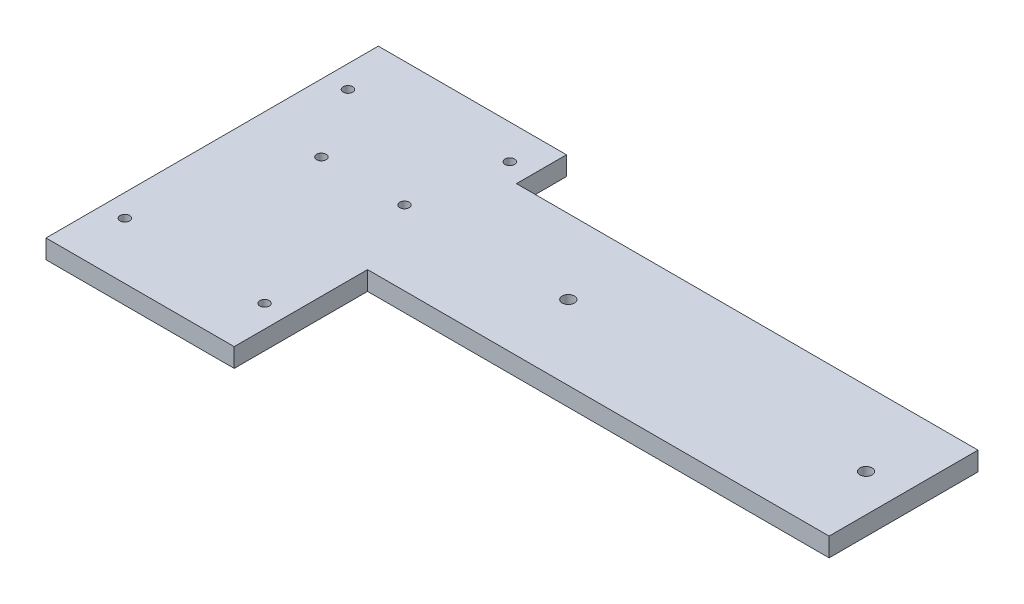
from build123d import *

# Parameters (mm, degrees)
SKETCH1_W           = 63.2
SKETCH1_H           = 111.6
SKETCH1_W_2         = 53.2
SKETCH1_H_2         = 101.6
SKETCH1_R           = 1.6
BOSS_EXTRUDE1_DEPTH = 6.35
SKETCH2_W           = 155
SKETCH2_H           = 50
SKETCH2_R           = 2.05
BOSS_EXTRUDE2_DEPTH = 6.35


with BuildPart() as part:
    # Sketch1 → Boss-Extrude1 (new body)
    # profile 1 of 2: a face of its own
    with BuildSketch(Plane(origin=(0, 0, 0), x_dir=(1, 0, 0), z_dir=(0, 1, 0))):
        with Locations((-26.6, 50.8)):
            Rectangle(SKETCH1_W, SKETCH1_H)
        with Locations((-26.6, 50.8)):
            Rectangle(SKETCH1_W_2, SKETCH1_H_2, mode=Mode.SUBTRACT)
    # profile 2 of 2: a face of its own
    with BuildSketch(Plane(origin=(0, 0, 0), x_dir=(1, 0, 0), z_dir=(0, 1, 0))):
        with Locations((-26.6, 50.8)):
            Rectangle(SKETCH1_W_2, SKETCH1_H_2)
        with Locations(Location((-2.5, 12.7, 0), (0, 0, 270))):
            Circle(SKETCH1_R, mode=Mode.SUBTRACT)
        with Locations(Location((-50.7, 14, 0), (0, 0, 270))):
            Circle(SKETCH1_R, mode=Mode.SUBTRACT)
        with Locations(Location((-7.6, 64.8, 0), (0, 0, 270))):
            Circle(SKETCH1_R, mode=Mode.SUBTRACT)
        with Locations(Location((-35.5, 64.8, 0), (0, 0, 270))):
            Circle(SKETCH1_R, mode=Mode.SUBTRACT)
        with Locations(Location((-2.5, 95.05, 0), (0, 0, 270))):
            Circle(SKETCH1_R, mode=Mode.SUBTRACT)
        with Locations(Location((-50.7, 88.9, 0), (0, 0, 270))):
            Circle(SKETCH1_R, mode=Mode.SUBTRACT)
    extrude(amount=BOSS_EXTRUDE1_DEPTH)

    # Sketch2 → Boss-Extrude2 (add)
    with BuildSketch(Plane(origin=(0, 6.35, 0), x_dir=(1, 0, 0), z_dir=(0, 1, 0))):
        with Locations((82.5, 64.8)):
            Rectangle(SKETCH2_W, SKETCH2_H)
        with Locations(Location((47.4, 64.8, 0), (0, 0, 270))):
            Circle(SKETCH2_R, mode=Mode.SUBTRACT)
        with Locations(Location((147.4, 64.8, 0), (0, 0, 270))):
            Circle(SKETCH2_R, mode=Mode.SUBTRACT)
    extrude(amount=-BOSS_EXTRUDE2_DEPTH)


solid = part.part
